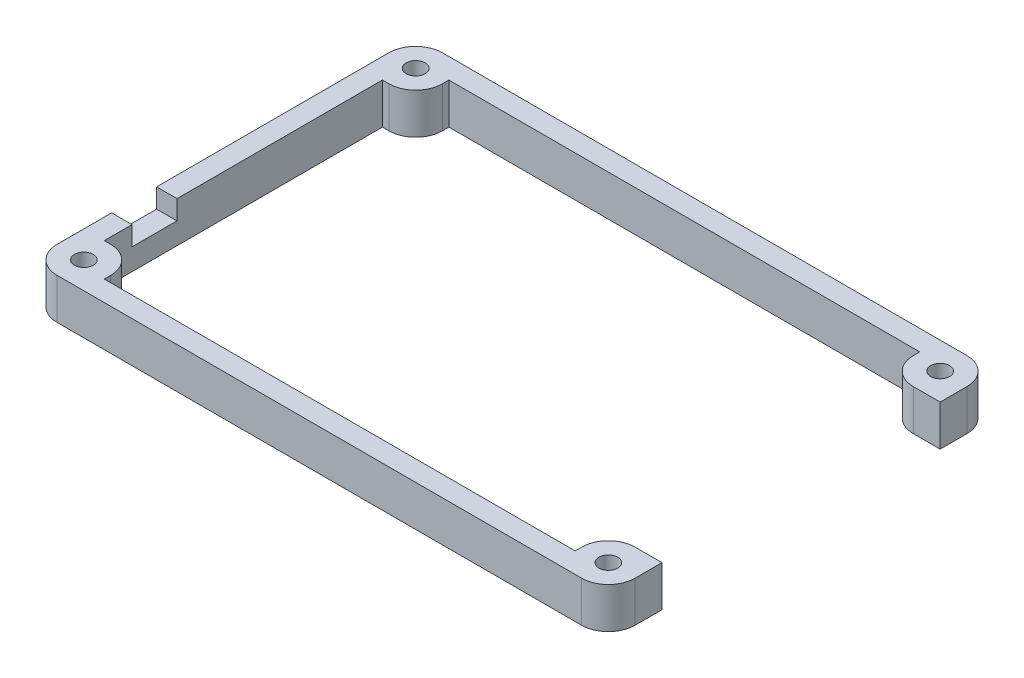
from build123d import *

# Parameters (mm, degrees)
BOSS_EXTRUDE3_DEPTH = 6.35
ANTENNA_HOLE_SIZE_W = 7
ANTENNA_HOLE_SIZE_H = 6
CUT_EXTRUDE3_DEPTH  = 3.175
SKETCH7_R           = 1.4732
CUT_EXTRUDE4_DEPTH  = 10
SKETCH8_W           = 3.175
SKETCH8_H           = 43.3
CUT_EXTRUDE5_DEPTH  = 55.454774814


with BuildPart() as part:
    # Sketch2 → Boss-Extrude3 (new body)
    with BuildSketch(Plane(origin=(0, 0, 0), x_dir=(1, 0, 0), z_dir=(0, 1, 0))):
        with BuildLine():
            Line((-45, 25.825), (-45, -25.825))
            ThreePointArc((-45, -25.825), (-43.777170811, -28.777170811), (-40.825, -30))
            Line((-40.825, -30), (40.825, -30))
            ThreePointArc((40.825, -30), (43.777170811, -28.777170811), (45, -25.825))
            Line((45, -25.825), (45, 25.825))
            ThreePointArc((45, 25.825), (43.777170811, 28.777170811), (40.825, 30))
            Line((40.825, 30), (-40.825, 30))
            ThreePointArc((-40.825, 30), (-43.777170811, 28.777170811), (-45, 25.825))
        make_face()
        with BuildLine():
            Line((40.825, 21.65), (41.825, 21.65))
            Line((41.825, 21.65), (41.825, -21.65))
            Line((41.825, -21.65), (40.825, -21.65))
            ThreePointArc((40.825, -21.65), (37.872829189, -22.872829189), (36.65, -25.825))
            Line((36.65, -25.825), (36.65, -26.825))
            Line((36.65, -26.825), (-36.65, -26.825))
            Line((-36.65, -26.825), (-36.65, -25.825))
            ThreePointArc((-36.65, -25.825), (-37.872829189, -22.872829189), (-40.825, -21.65))
            Line((-40.825, -21.65), (-41.825, -21.65))
            Line((-41.825, -21.65), (-41.825, 21.65))
            Line((-41.825, 21.65), (-40.825, 21.65))
            ThreePointArc((-40.825, 21.65), (-37.872829189, 22.872829189), (-36.65, 25.825))
            Line((-36.65, 25.825), (-36.65, 26.825))
            Line((-36.65, 26.825), (36.65, 26.825))
            Line((36.65, 26.825), (36.65, 25.825))
            ThreePointArc((36.65, 25.825), (37.872829189, 22.872829189), (40.825, 21.65))
        make_face(mode=Mode.SUBTRACT)
    extrude(amount=BOSS_EXTRUDE3_DEPTH)

    # Antenna Hole Size → Cut-Extrude3 (cut)
    with BuildSketch(Plane.ZY.offset(45)):
        with Locations((13.825, 6.35)):
            Rectangle(ANTENNA_HOLE_SIZE_W, ANTENNA_HOLE_SIZE_H)
    extrude(amount=-CUT_EXTRUDE3_DEPTH, mode=Mode.SUBTRACT)

    # Sketch7 → Cut-Extrude4 (cut)
    with BuildSketch(Plane.XZ):
        with Locations(Location((-40.825, -25.825, 0), (0, 0, 270))):
            Circle(SKETCH7_R)
        with Locations(Location((-40.825, 25.825, 0), (0, 0, 270))):
            Circle(SKETCH7_R)
        with Locations(Location((40.825, 25.825, 0), (0, 0, 270))):
            Circle(SKETCH7_R)
        with Locations(Location((40.825, -25.825, 0), (0, 0, 270))):
            Circle(SKETCH7_R)
    extrude(amount=-CUT_EXTRUDE4_DEPTH, mode=Mode.SUBTRACT)

    # Sketch8 → Cut-Extrude5 (cut, through all)
    with BuildSketch(Plane(origin=(0, 6.35, 0), x_dir=(1, 0, 0), z_dir=(0, 1, 0))):
        with Locations((43.4125, 0)):
            Rectangle(SKETCH8_W, SKETCH8_H)
    extrude(amount=-CUT_EXTRUDE5_DEPTH, mode=Mode.SUBTRACT)


solid = part.part
